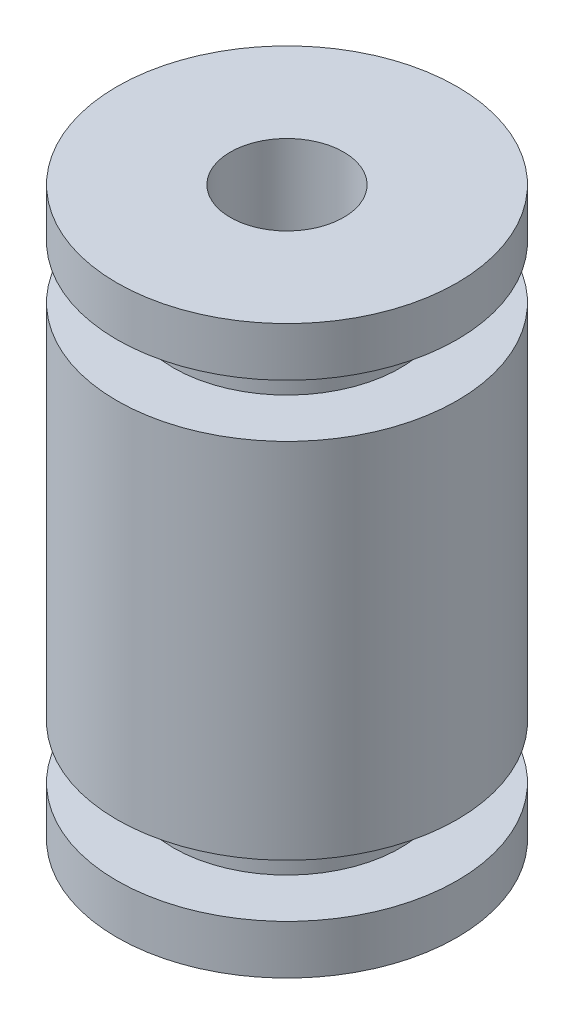
from build123d import *


with BuildPart() as part:
    # Croquis1 → Revolución1 (revolve)
    with BuildSketch(Plane.XY, mode=Mode.PRIVATE) as revoluci_n1_sk:
        Polygon((-1.5, 7.5), (-1.5, -7.5), (-4.5, -7.5), (-4.5, -6.2), (-3, -6.2), (-3, -4.8), (-4.5, -4.8), (-4.5, 4.8), (-3, 4.8), (-3, 6.2), (-4.5, 6.2), (-4.5, 7.5), align=None)
    revolve(revoluci_n1_sk.sketch.rotate(Axis((0, 0, 0), (0, 1, 0)), 270), axis=Axis((0, 0, 0), (0, 1, 0)))


solid = part.part
